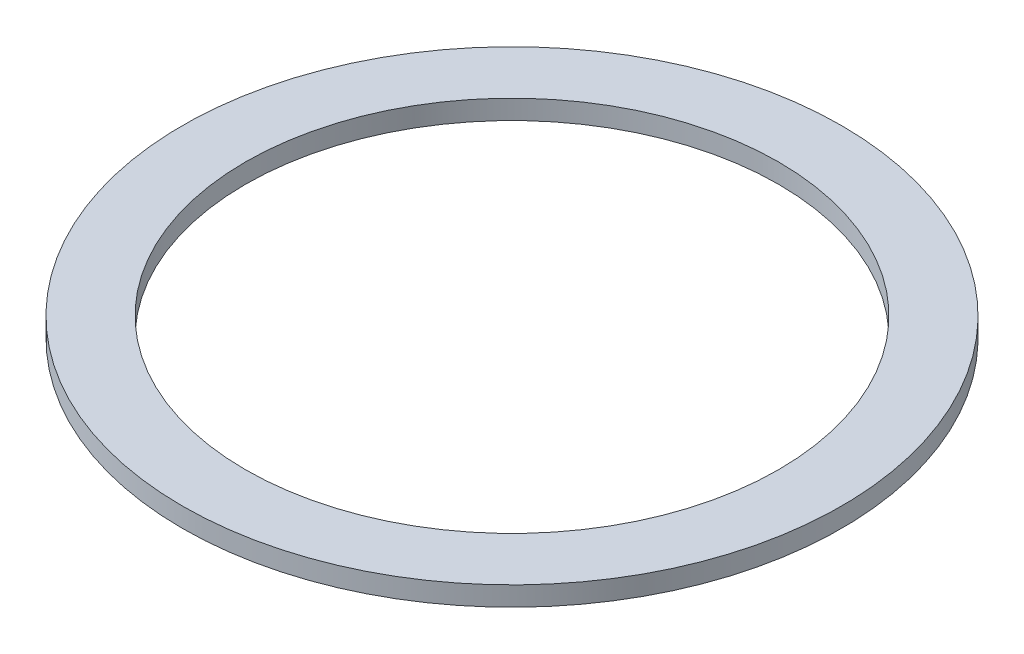
from build123d import *

# Parameters (mm, degrees)
BOSS_EXTRUDE1_DEPTH      = 1
BOSS_EXTRUDE1_DEPTH_BACK = 1
SKETCH3_R                = 34
SKETCH3_R_2              = 27.5


with BuildPart() as part:
    # Sketch3 → Boss-Extrude1 (new, two sides: drawn at the far end of the back side and taken through both)
    with BuildSketch(Plane(origin=(0, 0, 0), x_dir=(1, 0, 0), z_dir=(0, 1, 0)).offset(-BOSS_EXTRUDE1_DEPTH_BACK)):
        with Locations(Location((0, 0, 0), (0, 0, 270))):
            Circle(SKETCH3_R)
        with Locations(Location((0, 0, 0), (0, 0, 270))):
            Circle(SKETCH3_R_2, mode=Mode.SUBTRACT)
    extrude(amount=BOSS_EXTRUDE1_DEPTH + BOSS_EXTRUDE1_DEPTH_BACK)


solid = part.part
